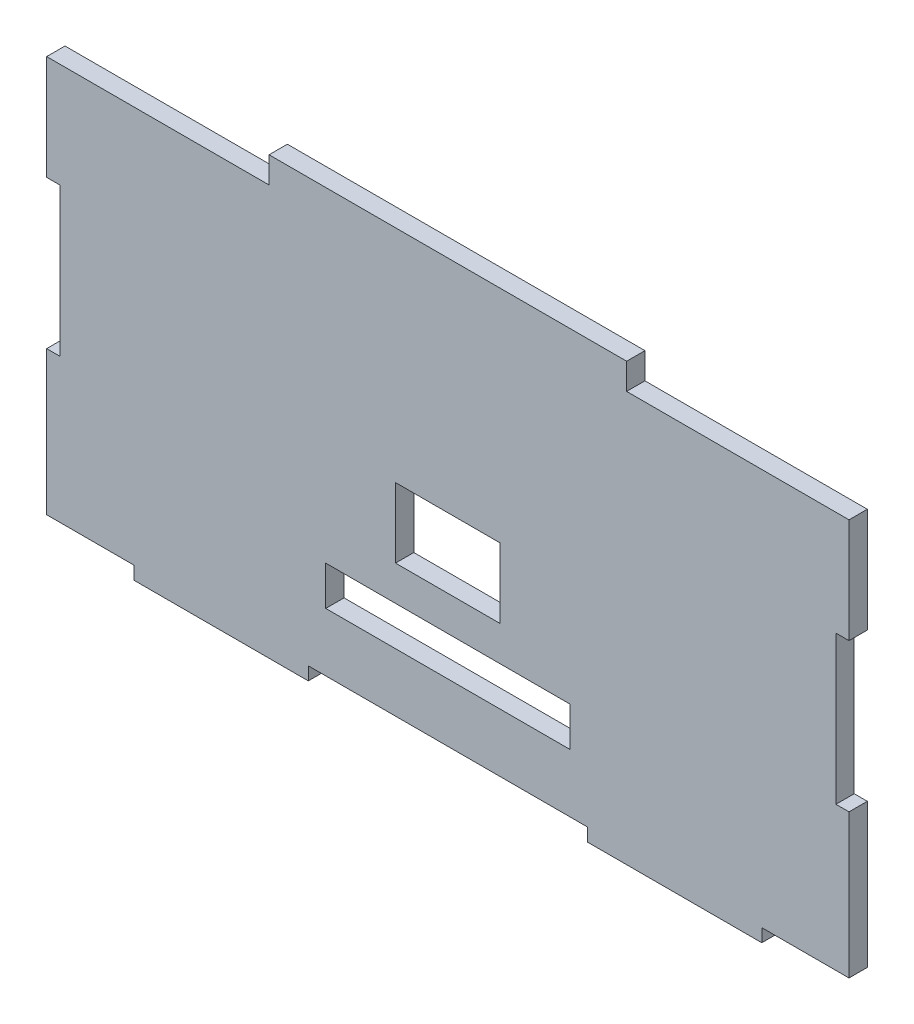
from build123d import *

# Parameters (mm, degrees)
BOSS_EXTRUDE1_DEPTH = 2.1
SKETCH2_W           = 28
SKETCH2_H           = 4.5
SKETCH2_W_2         = 12
SKETCH2_H_2         = 8
CUT_EXTRUDE2_DEPTH  = 54.128711635
SKETCH3_W           = 1.5
SKETCH3_H           = 17
SKETCH3_W_2         = 10
SKETCH3_H_2         = 1.5
SKETCH3_W_3         = 32
CUT_EXTRUDE3_DEPTH  = 54.128711635


with BuildPart() as part:
    # Sketch1 → Boss-Extrude1 (new body)
    with BuildSketch(Plane.XY):
        Polygon((-46, 23.5), (-20.5, 23.5), (-20.5, 26.5), (20.5, 26.5), (20.5, 23.5), (46, 23.5), (46, -23.5), (-46, -23.5), align=None)
    extrude(amount=-BOSS_EXTRUDE1_DEPTH)

    # Sketch2 → Cut-Extrude2 (cut, through all)
    with BuildSketch(Plane.XY):
        with Locations((0, -13.05)):
            Rectangle(SKETCH2_W, SKETCH2_H)
        with Locations((0, -2.8)):
            Rectangle(SKETCH2_W_2, SKETCH2_H_2)
    extrude(amount=-CUT_EXTRUDE2_DEPTH, mode=Mode.SUBTRACT)

    # Sketch3 → Cut-Extrude3 (cut, through all)
    with BuildSketch(Plane.XY):
        with Locations((-45.25, 3)):
            Rectangle(SKETCH3_W, SKETCH3_H)
        with Locations((-41, -22.75)):
            Rectangle(SKETCH3_W_2, SKETCH3_H_2)
        with Locations((0, -22.75)):
            Rectangle(SKETCH3_W_3, SKETCH3_H_2)
        with Locations((41, -22.75)):
            Rectangle(SKETCH3_W_2, SKETCH3_H_2)
        with Locations((45.25, 3)):
            Rectangle(SKETCH3_W, SKETCH3_H)
    extrude(amount=-CUT_EXTRUDE3_DEPTH, mode=Mode.SUBTRACT)


solid = part.part
